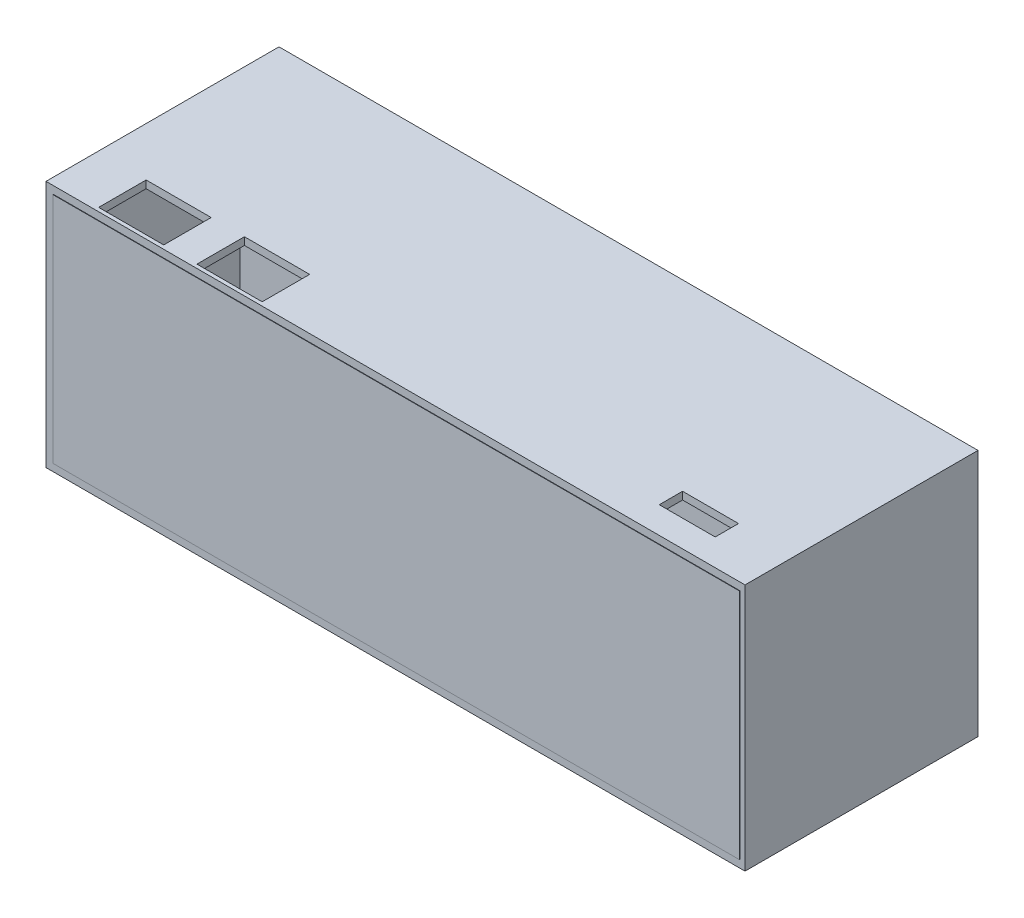
from build123d import *

# Parameters (mm, degrees)
SKETCH_1_W                = 150
SKETCH_1_H                = 53.201915286
EXTRUDE_1_DEPTH           = 25
CUT_EXTRUDE_4_DEPTH       = 132.308761728
CUT_EXTRUDE_4_DEPTH_BACK  = 132.308761728
SKETCH_2_W                = 13.960564471
SKETCH_2_H                = 10.187423892
SKETCH_2_W_2              = 14
SKETCH_2_W_3              = 12
SKETCH_2_H_2              = 5
SKETCH_4_W                = 147.277496434
SKETCH_4_H                = 49.937069792
CUT_EXTRUDE_9_DEPTH       = 40
EXTRUDE_2_DEPTH           = 0.1
EXTRUDE_2_DEPTH_BACK      = 2
SKETCH_6_W                = 147.277496434
SKETCH_6_H                = 49.937069792
CUT_EXTRUDE_11_DEPTH      = 132.012543018
CUT_EXTRUDE_11_DEPTH_BACK = 0.1
SKETCH_7_R                = 0.5


with BuildPart() as part:
    # 草图1 → 凸台-拉伸1 (new, symmetric)
    with BuildSketch(Plane.XY):
        with Locations((42.416128008, 6.167004021)):
            Rectangle(SKETCH_1_W, SKETCH_1_H)
    extrude(amount=EXTRUDE_1_DEPTH, both=True)

    # 草图2 → 切除-拉伸4 (cut, two sides: drawn at the far end of the back side and taken through both)
    with BuildSketch(Plane(origin=(0, 32.767961664, 0), x_dir=(1, 0, 0), z_dir=(0, 1, 0)).offset(-CUT_EXTRUDE_4_DEPTH_BACK)):
        with Locations((-15.114618297, -19.093711946)):
            Rectangle(SKETCH_2_W, SKETCH_2_H)
        with Locations((5.995879761, -19.093711946)):
            Rectangle(SKETCH_2_W_2, SKETCH_2_H)
        with Locations((99.312670009, -16.792388629)):
            Rectangle(SKETCH_2_W_3, SKETCH_2_H_2)
    extrude(amount=CUT_EXTRUDE_4_DEPTH + CUT_EXTRUDE_4_DEPTH_BACK, mode=Mode.SUBTRACT)

    # 草图4 → 切除-拉伸9 (cut)
    with BuildSketch(Plane.XY.offset(25)):
        with Locations((42.684765752, 6.174377474)):
            Rectangle(SKETCH_4_W, SKETCH_4_H)
    extrude(amount=-CUT_EXTRUDE_9_DEPTH, mode=Mode.SUBTRACT)

    # 草图6 → 凸台-拉伸2 (add, two sides: drawn at the far end of the back side and taken through both)
    with BuildSketch(Plane.XY.offset(25).offset(-EXTRUDE_2_DEPTH_BACK)):
        with Locations((42.684765752, 6.174377474)):
            Rectangle(SKETCH_6_W, SKETCH_6_H)
    extrude(amount=EXTRUDE_2_DEPTH + EXTRUDE_2_DEPTH_BACK)

    # 草图7 → 切除-拉伸11 (cut, two sides: drawn at the far end of the back side and taken through both)
    with BuildSketch(Plane(origin=(0, 0, 23), x_dir=(-1, 0, 0), z_dir=(0, 0, -1)).offset(-CUT_EXTRUDE_11_DEPTH_BACK)):
        with Locations((-112.698705999, 6.167004021)):
            Circle(SKETCH_7_R)
        with Locations((27.866449983, 6.174377474)):
            Circle(SKETCH_7_R)
    extrude(amount=CUT_EXTRUDE_11_DEPTH + CUT_EXTRUDE_11_DEPTH_BACK, mode=Mode.SUBTRACT)


solid = part.part
